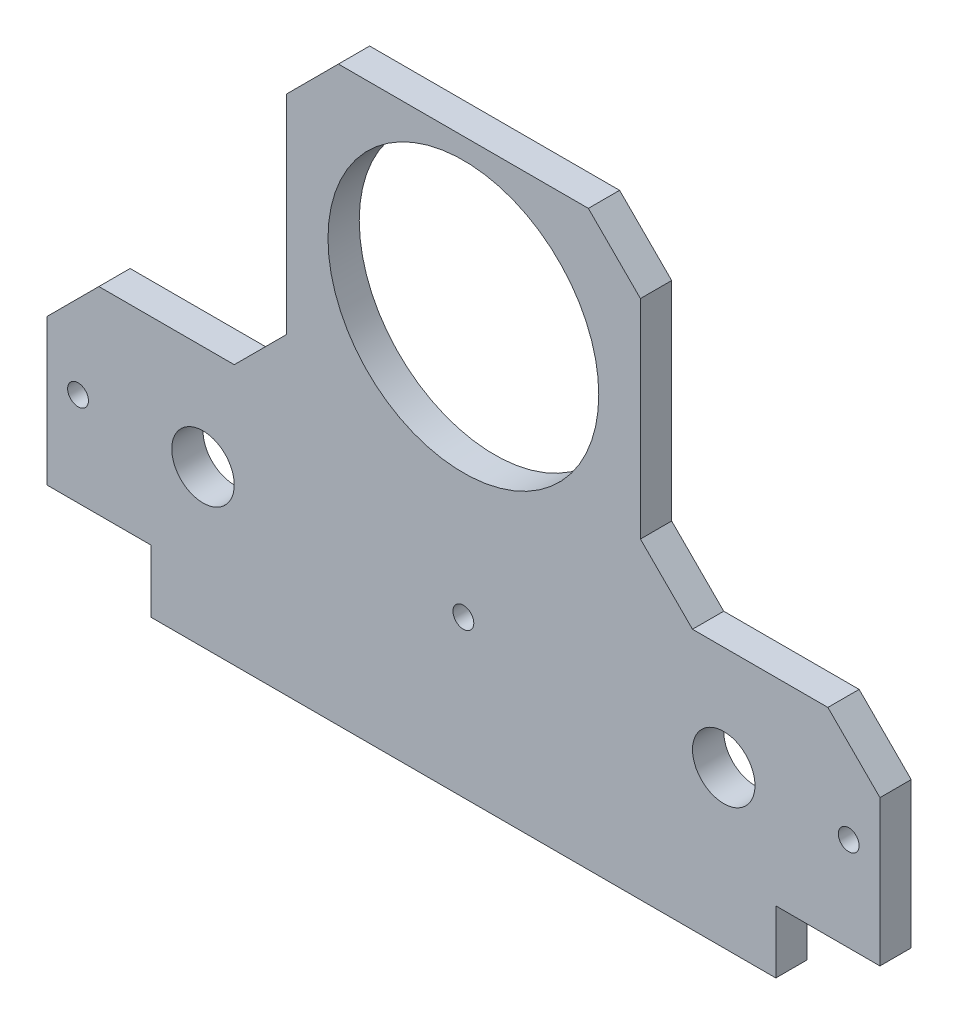
from build123d import *

# Parameters (mm, degrees)
ESQUISSE1_R             = 13
BOSS_EXTRU_1_DEPTH      = 12
BOSS_EXTRU_2_START      = -12
ESQUISSE2_R             = 13
ESQUISSE2_R_2           = 5.5
BOSS_EXTRU_2_DEPTH      = 3
ESQUISSE4_R             = 8
ENL_V_MAT_EXTRU_2_DEPTH = 6
ESQUISSE5_R             = 3
ENL_V_MAT_EXTRU_3_DEPTH = 69.271516755
ENL_V_START             = -12
ESQUISSE6_W             = 10
ESQUISSE6_H             = 6
ENL_V_MAT_EXTRU_4_DEPTH = 12
CHANFREIN1_SIZE         = 5
ESQUISSE7_R             = 1
ENL_V_MAT_EXTRU_5_DEPTH = 12
ESQUISSE8_W             = 80
ESQUISSE8_H             = 9
ENL_V_MAT_EXTRU_6_DEPTH = 70.057946682


with BuildPart() as part:
    # Esquisse1 → Boss.-Extru.1 (new body)
    with BuildSketch(Plane.XY):
        Polygon((-40, 0), (40, 0), (40, 25), (17, 25), (17, 55), (-17, 55), (-17, 25), (-40, 25), align=None)
        with Locations((0, 40)):
            Circle(ESQUISSE1_R, mode=Mode.SUBTRACT)
    extrude(amount=BOSS_EXTRU_1_DEPTH)

    # Esquisse2 → Boss.-Extru.2 (add)
    with BuildSketch(Plane.XY.offset(12).offset(BOSS_EXTRU_2_START)):
        with Locations((0, 40)):
            Circle(ESQUISSE2_R)
        with Locations((0, 40)):
            Circle(ESQUISSE2_R_2, mode=Mode.SUBTRACT)
    extrude(amount=BOSS_EXTRU_2_DEPTH)

    # Esquisse4 → Enlèv. mat.-Extru.2 (cut)
    with BuildSketch(Plane(origin=(0, 0, 0), x_dir=(-1, 0, 0), z_dir=(0, 0, -1))):
        with Locations((-25, 15)):
            Circle(ESQUISSE4_R)
        with Locations(Location((25, 15, 0), (0, 0, 180))):
            Circle(ESQUISSE4_R)
    extrude(amount=-ENL_V_MAT_EXTRU_2_DEPTH, mode=Mode.SUBTRACT)

    # Esquisse5 → Enlèv. mat.-Extru.3 (cut, through all)
    with BuildSketch(Plane(origin=(0, 0, 6), x_dir=(-1, 0, 0), z_dir=(0, 0, -1))):
        with Locations((-25, 15)):
            Circle(ESQUISSE5_R)
        with Locations(Location((25, 15, 0), (0, 0, 180))):
            Circle(ESQUISSE5_R)
    extrude(amount=-ENL_V_MAT_EXTRU_3_DEPTH, mode=Mode.SUBTRACT)

    # Esquisse6 → Enlèv. mat.-Extru.4 (cut)
    with BuildSketch(Plane.XY.offset(12).offset(ENL_V_START)):
        with Locations((35, 3)):
            Rectangle(ESQUISSE6_W, ESQUISSE6_H)
        with Locations((-35, 3)):
            Rectangle(ESQUISSE6_W, ESQUISSE6_H)
    extrude(amount=ENL_V_MAT_EXTRU_4_DEPTH, mode=Mode.SUBTRACT)

    # Chanfrein1
    chanfrein1_edges = [part.edges().sort_by_distance(p)[0] for p in [
        (-17, 55, 6),
        (17, 55, 6),
        (17, 25, 6),
        (40, 25, 6),
        (-40, 25, 6),
        (-17, 25, 6),
    ]]
    chamfer(chanfrein1_edges, length=CHANFREIN1_SIZE)

    # Esquisse7 → Enlèv. mat.-Extru.5 (cut)
    with BuildSketch(Plane(origin=(0, 0, 0), x_dir=(-1, 0, 0), z_dir=(0, 0, -1))):
        with Locations((-10, 45)):
            Circle(ESQUISSE7_R)
        with Locations(Location((10, 45, 0), (0, 0, 180))):
            Circle(ESQUISSE7_R)
        with Locations((-37, 15)):
            Circle(ESQUISSE7_R)
        with Locations(Location((37, 15, 0), (0, 0, 180))):
            Circle(ESQUISSE7_R)
        with Locations((0, 15)):
            Circle(ESQUISSE7_R)
    extrude(amount=-ENL_V_MAT_EXTRU_5_DEPTH, mode=Mode.SUBTRACT)

    # Esquisse8 → Enlèv. mat.-Extru.6 (cut, through all)
    with BuildSketch(Plane(origin=(0, 55, 0), x_dir=(1, 0, 0), z_dir=(0, 1, 0))):
        with Locations((0, -4.5)):
            Rectangle(ESQUISSE8_W, ESQUISSE8_H)
    extrude(amount=-ENL_V_MAT_EXTRU_6_DEPTH, mode=Mode.SUBTRACT)


solid = part.part
